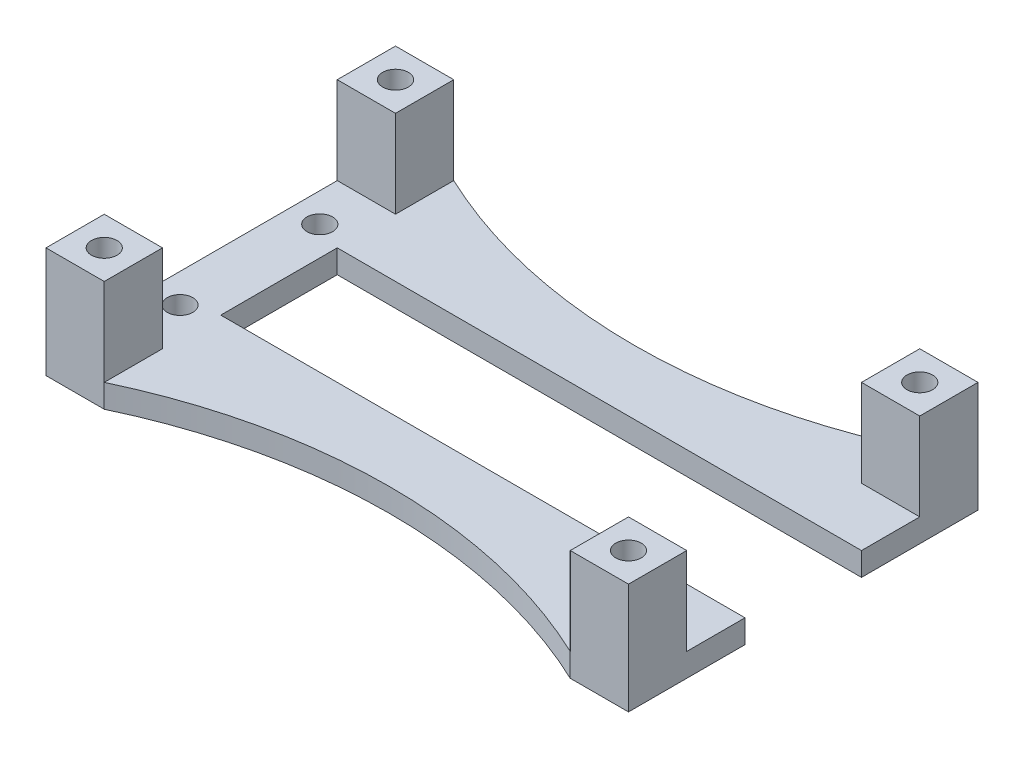
from build123d import *

# Parameters (mm, degrees)
SKETCH1_R                  = 2.2
EXTRUDE_BODY_DEPTH         = 4
SKETCH5_W                  = 10
SKETCH5_H                  = 10
SKETCH5_R                  = 2.2
EXTRUDE_LEGS_DEPTH         = 15
SKETCH6_R                  = 4.215
CUT_BOLT_HEAD_INSETS_DEPTH = 2.5


with BuildPart() as part:
    # Sketch1 → Extrude-Body (new body)
    with BuildSketch(Plane(origin=(0, 0, 0), x_dir=(1, 0, 0), z_dir=(0, 1, 0))):
        with BuildLine():
            Line((10, -10), (10, 10))
            Line((10, 10), (100, 10))
            Line((100, 10), (100, 30))
            Line((100, 30), (90, 30))
            ThreePointArc((90, 30), (50, 21), (10, 30))
            Line((10, 30), (0, 30))
            Line((0, 30), (0, -30))
            Line((0, -30), (10, -30))
            ThreePointArc((10, -30), (50, -21), (90, -30))
            Line((90, -30), (100, -30))
            Line((100, -30), (100, -10))
            Line((100, -10), (10, -10))
        make_face()
        with Locations(Location((5, -12, 0), (0, 0, 270))):
            Circle(SKETCH1_R, mode=Mode.SUBTRACT)
        with Locations(Location((5, 12, 0), (0, 0, 270))):
            Circle(SKETCH1_R, mode=Mode.SUBTRACT)
        with Locations(Location((95, 25, 0), (0, 0, 270))):
            Circle(SKETCH1_R, mode=Mode.SUBTRACT)
        with Locations(Location((95, -25, 0), (0, 0, 270))):
            Circle(SKETCH1_R, mode=Mode.SUBTRACT)
        with Locations(Location((5, 25, 0), (0, 0, 270))):
            Circle(SKETCH1_R, mode=Mode.SUBTRACT)
        with Locations(Location((5, -25, 0), (0, 0, 270))):
            Circle(SKETCH1_R, mode=Mode.SUBTRACT)
    extrude(amount=EXTRUDE_BODY_DEPTH)

    # Sketch5 → Extrude-Legs (add)
    # profile 1 of 4: a face of its own
    with BuildSketch(Plane(origin=(0, 4, 0), x_dir=(1, 0, 0), z_dir=(0, 1, 0))):
        with Locations((95, -25)):
            Rectangle(SKETCH5_W, SKETCH5_H)
        with Locations(Location((95, -25, 0), (0, 0, 270))):
            Circle(SKETCH5_R, mode=Mode.SUBTRACT)
    # profile 2 of 4: a face of its own
    with BuildSketch(Plane(origin=(0, 4, 0), x_dir=(1, 0, 0), z_dir=(0, 1, 0))):
        with Locations((95, 25)):
            Rectangle(SKETCH5_W, SKETCH5_H)
        with Locations(Location((95, 25, 0), (0, 0, 270))):
            Circle(SKETCH5_R, mode=Mode.SUBTRACT)
    # profile 3 of 4: a face of its own
    with BuildSketch(Plane(origin=(0, 4, 0), x_dir=(1, 0, 0), z_dir=(0, 1, 0))):
        with Locations((5, 25)):
            Rectangle(SKETCH5_W, SKETCH5_H)
        with Locations(Location((5, 25, 0), (0, 0, 270))):
            Circle(SKETCH5_R, mode=Mode.SUBTRACT)
    # profile 4 of 4: a face of its own
    with BuildSketch(Plane(origin=(0, 4, 0), x_dir=(1, 0, 0), z_dir=(0, 1, 0))):
        with Locations((5, -25)):
            Rectangle(SKETCH5_W, SKETCH5_H)
        with Locations(Location((5, -25, 0), (0, 0, 270))):
            Circle(SKETCH5_R, mode=Mode.SUBTRACT)
    extrude(amount=EXTRUDE_LEGS_DEPTH)

    # Sketch6 → Cut-Bolt Head Insets (cut)
    with BuildSketch(Plane.XZ):
        with Locations(Location((5, -25, 0), (0, 0, 270))):
            Circle(SKETCH6_R)
        with Locations(Location((5, 25, 0), (0, 0, 270))):
            Circle(SKETCH6_R)
        with Locations(Location((95, 25, 0), (0, 0, 270))):
            Circle(SKETCH6_R)
        with Locations(Location((95, -25, 0), (0, 0, 270))):
            Circle(SKETCH6_R)
    extrude(amount=-CUT_BOLT_HEAD_INSETS_DEPTH, mode=Mode.SUBTRACT)


solid = part.part
